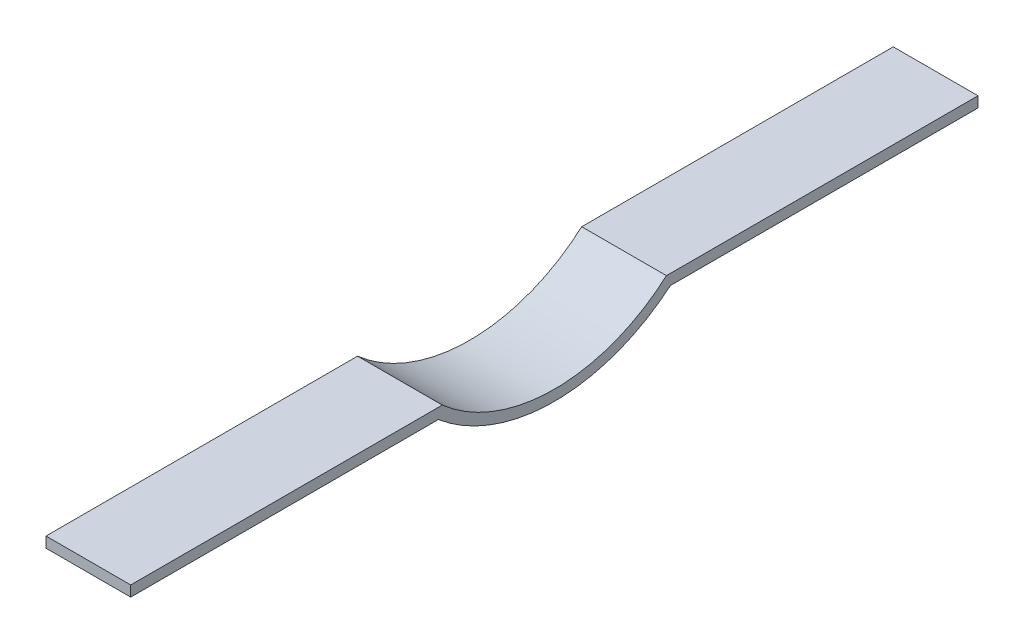
from build123d import *

# Parameters (mm, degrees)
BOSS_EXTRUDE1_DEPTH      = 25.4
BOSS_EXTRUDE2_REACH      = 350.576
BOSS_EXTRUDE2_END_RADIUS = 107.95
SKETCH2_W                = 50.8
SKETCH2_H                = 6.35


with BuildPart() as part:
    # Sketch1 → Boss-Extrude1 (new, symmetric)
    with BuildSketch(Plane(origin=(0, 0, 0), x_dir=(0, 0, -1), z_dir=(1, 0, 0))):
        with BuildLine():
            Line((-76.464125575, -76.2), (-67.202083301, -76.2))
            ThreePointArc((-67.202083301, -76.2), (0, -101.6), (67.202083301, -76.2))
            Line((67.202083301, -76.2), (76.464125575, -76.2))
            ThreePointArc((76.464125575, -76.2), (0, -107.95), (-76.464125575, -76.2))
        make_face()
    extrude(amount=BOSS_EXTRUDE1_DEPTH, both=True)

    # Boss-Extrude2: up to this cylinder (the profile starts outside it)
    boss_extrude2_end = Plane(origin=(0, 0, 0), z_dir=(-1, 0, 0)) * Cylinder(BOSS_EXTRUDE2_END_RADIUS, 918.052, mode=Mode.PRIVATE)
    # Sketch2 → Boss-Extrude2 (add, up to the surface)
    with BuildSketch(Plane.XY.offset(254), mode=Mode.PRIVATE) as boss_extrude2_sk1:
        with Locations((0, -79.375)):
            Rectangle(SKETCH2_W, SKETCH2_H)
    boss_extrude2_tool1 = extrude(boss_extrude2_sk1.sketch, amount=-BOSS_EXTRUDE2_REACH, mode=Mode.PRIVATE) - boss_extrude2_end
    boss_extrude2 = boss_extrude2_tool1.solids().sort_by_distance((0, -79.375, 254))[0]
    add(boss_extrude2)

    # Mirror1: Boss-Extrude2 across plane
    add(boss_extrude2.mirror(Plane.XY))


solid = part.part
